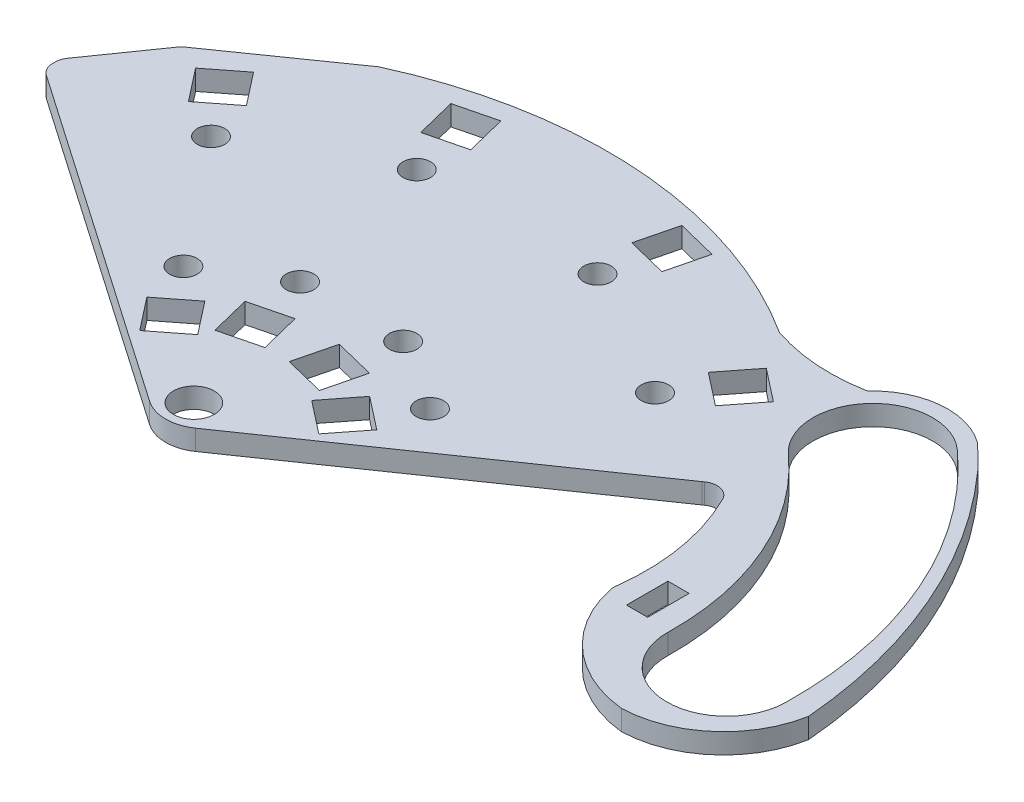
from build123d import *

# Parameters (mm, degrees)
SKETCH1_R           = 3.2004
SKETCH1_R_2         = 2.159
SKETCH1_W           = 3.3274
SKETCH1_H           = 6.5024
BOSS_EXTRUDE1_DEPTH = 3.175
FILLET1_R           = 6.35
CUT_EXTRUDE1_DEPTH  = 119.620638985
CUT_EXTRUDE2_DEPTH  = 119.620638985


with BuildPart() as part:
    # Sketch1 → Boss-Extrude1 (new body)
    with BuildSketch(Plane(origin=(0, 0, 0), x_dir=(1, 0, 0), z_dir=(0, 1, 0))):
        with BuildLine():
            Line((46.403243059, 26.253216793), (50.58203093, 29.139941438))
            Line((50.58203093, 29.139941438), (50.810401684, 29.296808651))
            ThreePointArc((50.810401684, 29.296808651), (52.903191273, 29.710570717), (54.573236871, 28.38319925))
            ThreePointArc((54.573236871, 28.38319925), (57.812038803, 18.519910789), (58.021057072, 8.140575136))
            ThreePointArc((58.021057072, 8.140575136), (58.019631397, 7.454008247), (58.110797015, 6.773519483))
            ThreePointArc((58.110797015, 6.773519483), (77.605374828, -7.708974753), (90.50576443, 12.866767069))
            ThreePointArc((90.50576443, 12.866767069), (43.472529066, 70.626376988), (-30.323774881, 60.506925891))
            ThreePointArc((-30.323774881, 60.506925891), (-30.739824891, 60.355496072), (-31.123258654, 60.134120485))
            Line((-31.123258654, 60.134120485), (-48.980521588, 47.630330367))
            ThreePointArc((-48.980521588, 47.630330367), (-49.319688664, 47.345735399), (-49.604283632, 47.006568323))
            Line((-49.604283632, 47.006568323), (-56.690646192, 36.886193758))
            ThreePointArc((-56.690646192, 36.886193758), (-57.032441055, 36.19310234), (-57.15, 35.429309609))
            Line((-57.15, 35.429309609), (-57.15, 35.009609836))
            ThreePointArc((-57.15, 35.009609836), (-56.859279722, 33.82963495), (-56.053668716, 32.919772369))
            Line((-56.053668716, 32.919772369), (-50.58203093, 29.139941438))
            Line((-50.58203093, 29.139941438), (-46.403243059, 26.253216793))
            Line((-46.403243059, 26.253216793), (0, -5.80234322))
            Line((0, -5.80234322), (46.403243059, 26.253216793))
        make_face()
        with Locations(Location((0, 0, 0), (0, 0, 270))):
            Circle(SKETCH1_R, mode=Mode.SUBTRACT)
        with Locations(Location((-14.172189073, 49.146835797, 0), (0, 0, 270))):
            Circle(SKETCH1_R_2, mode=Mode.SUBTRACT)
        with Locations(Location((-8.088821086, 24.747779464, 0), (0, 0, 90))):
            Circle(SKETCH1_R_2, mode=Mode.SUBTRACT)
        with Locations(Location((-34.819826997, 37.519095065, 0), (0, 0, 270))):
            Circle(SKETCH1_R_2, mode=Mode.SUBTRACT)
        with Locations(Location((-19.338403539, 17.703776655, 0), (0, 0, 90))):
            Circle(SKETCH1_R_2, mode=Mode.SUBTRACT)
        with Locations(Location((34.819826997, 37.519095065, 0), (0, 0, 90))):
            Circle(SKETCH1_R_2, mode=Mode.SUBTRACT)
        with Locations(Location((19.338403539, 17.703776655, 0), (0, 0, 270))):
            Circle(SKETCH1_R_2, mode=Mode.SUBTRACT)
        with Locations(Location((8.088821086, 24.747779464, 0), (0, 0, 270))):
            Circle(SKETCH1_R_2, mode=Mode.SUBTRACT)
        with Locations(Location((14.172189073, 49.146835797, 0), (0, 0, 90))):
            Circle(SKETCH1_R_2, mode=Mode.SUBTRACT)
        Polygon((-14.194632296, 62.360921096), (-20.479237716, 60.793992979), (-18.912309598, 54.50938756), (-12.627704179, 56.076315677), align=None, mode=Mode.SUBTRACT)
        Polygon((-3.471928118, 19.354503621), (-9.756533537, 17.787575503), (-8.189605419, 11.502970084), (-1.905, 13.069898202), align=None, mode=Mode.SUBTRACT)
        Polygon((-12.927019028, 14.654633554), (-18.030964679, 10.666994178), (-14.043325303, 5.563048527), (-8.939379652, 9.550687903), align=None, mode=Mode.SUBTRACT)
        Polygon((-36.227343223, 44.477688535), (-41.331288874, 40.490049159), (-45.31892825, 45.59399481), (-40.214982599, 49.581634186), align=None, mode=Mode.SUBTRACT)
        Polygon((40.214982599, 49.581634186), (45.31892825, 45.59399481), (41.331288874, 40.490049159), (36.227343223, 44.477688535), align=None, mode=Mode.SUBTRACT)
        Polygon((8.939379652, 9.550687903), (14.043325303, 5.563048527), (18.030964679, 10.666994178), (12.927019028, 14.654633554), align=None, mode=Mode.SUBTRACT)
        Polygon((9.756533537, 17.787575503), (8.189605419, 11.502970084), (1.905, 13.069898202), (3.471928118, 19.354503621), align=None, mode=Mode.SUBTRACT)
        Polygon((14.194632296, 62.360921096), (12.627704179, 56.076315677), (18.912309598, 54.50938756), (20.479237716, 60.793992979), align=None, mode=Mode.SUBTRACT)
        with Locations((63.088721213, 9.69176707)):
            Rectangle(SKETCH1_W, SKETCH1_H, mode=Mode.SUBTRACT)
    extrude(amount=BOSS_EXTRUDE1_DEPTH)

    # Fillet1
    fillet1_edges = [part.edges().sort_by_distance(p)[0] for p in [
        (0, 1.5875, 5.80234322),
    ]]
    fillet(fillet1_edges, radius=FILLET1_R)

    # Sketch2 → Cut-Extrude1 (cut, through all)
    with BuildSketch(Plane(origin=(0, 3.175, 0), x_dir=(1, 0, 0), z_dir=(0, 1, 0))):
        with BuildLine():
            ThreePointArc((87.135212516, 5.657351319), (81.909051328, 31.878788039), (66.223051077, 53.53117591))
            ThreePointArc((66.223051077, 53.53117591), (52.97426357, 52.779767692), (53.725671788, 39.530980185))
            ThreePointArc((53.725671788, 39.530980185), (64.711476112, 24.366572912), (68.371656098, 6.002199057))
            ThreePointArc((68.371656098, 6.002199057), (77.581010438, -3.552003021), (87.135212516, 5.657351319))
        make_face()
    extrude(amount=-CUT_EXTRUDE1_DEPTH, mode=Mode.SUBTRACT)

    # Sketch3 → Cut-Extrude2 (cut, through all)
    with BuildSketch(Plane(origin=(0, 3.175, 0), x_dir=(1, 0, 0), z_dir=(0, 1, 0))):
        with BuildLine():
            ThreePointArc((91.082221145, -2.183816518), (85.424919637, 28.55421491), (68.37898463, 54.750927226))
            ThreePointArc((68.37898463, 54.750927226), (59.749990126, 58.284939929), (51.262155566, 54.424181401))
            ThreePointArc((51.262155566, 54.424181401), (43.754739182, 53.985373594), (36.383549974, 55.4751463))
            ThreePointArc((36.383549974, 55.4751463), (3.225200598, 66.426758828), (-31.123258654, 60.134120485))
            ThreePointArc((-31.123258654, 60.134120485), (64.717904465, 75.405291468), (123.015996485, -2.183816518))
            ThreePointArc((123.015996485, -2.183816518), (86.509258073, -24.398136946), (58.019631397, 7.454008247))
            ThreePointArc((58.019631397, 7.454008247), (71.64980722, -7.317202642), (91.082221145, -2.183816518))
        make_face()
    extrude(amount=-CUT_EXTRUDE2_DEPTH, mode=Mode.SUBTRACT)


solid = part.part
